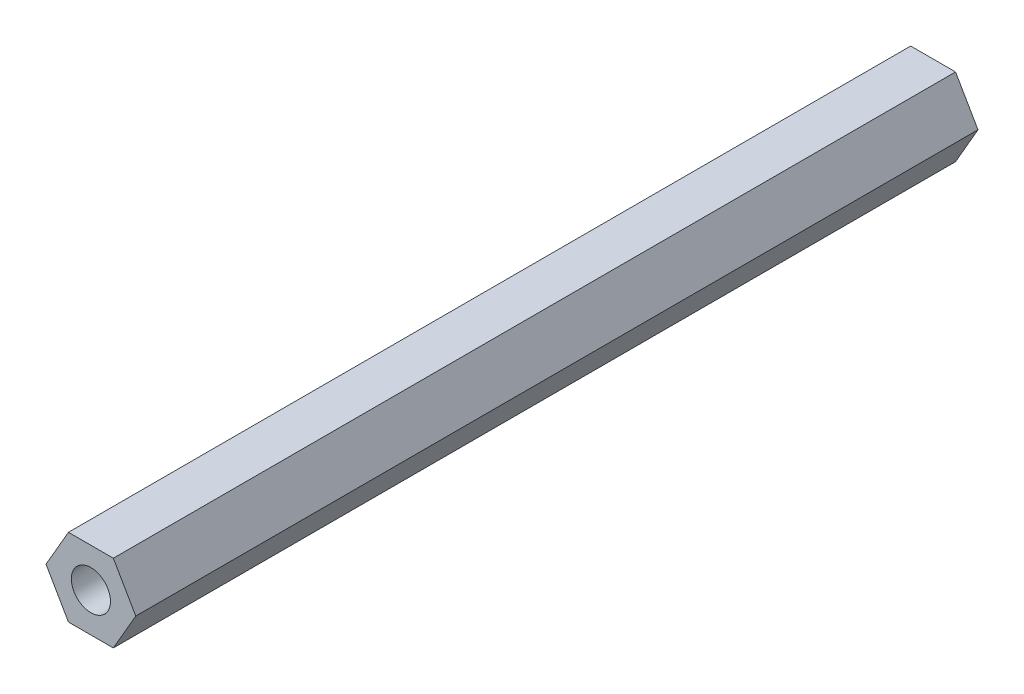
from build123d import *

# Parameters (mm, degrees)
F_70MM_DEPTH           = 65
SKETCH_M3_R            = 1.51
CUT_EXTRUDE_M3_DEPTH   = 8
CUT_EXTRUDE_START      = -8
SKETCH_M3_2_R          = 1.51
CUT_EXTRUDE_M3_2_DEPTH = 8


with BuildPart() as part:
    # Sketch 185 → 隔柱高度_70mm (new body)
    with BuildSketch(Plane.XY):
        Polygon((3.464101615, 0), (1.732050808, 3), (-1.732050808, 3), (-3.464101615, 0), (-1.732050808, -3), (1.732050808, -3), align=None)
    extrude(amount=F_70MM_DEPTH)

    # Sketch M3 → Cut-Extrude M3 (cut)
    with BuildSketch(Plane(origin=(0, 0, 0), x_dir=(-1, 0, 0), z_dir=(0, 0, -1))):
        Circle(SKETCH_M3_R)
    extrude(amount=-CUT_EXTRUDE_M3_DEPTH, mode=Mode.SUBTRACT)

    # Sketch M3 2 → Cut-Extrude M3 2 (cut)
    with BuildSketch(Plane.XY.offset(65).offset(CUT_EXTRUDE_START)):
        with Locations(Location((0, 0, 0), (0, 0, 180))):
            Circle(SKETCH_M3_2_R)
    extrude(amount=CUT_EXTRUDE_M3_2_DEPTH, mode=Mode.SUBTRACT)


solid = part.part
